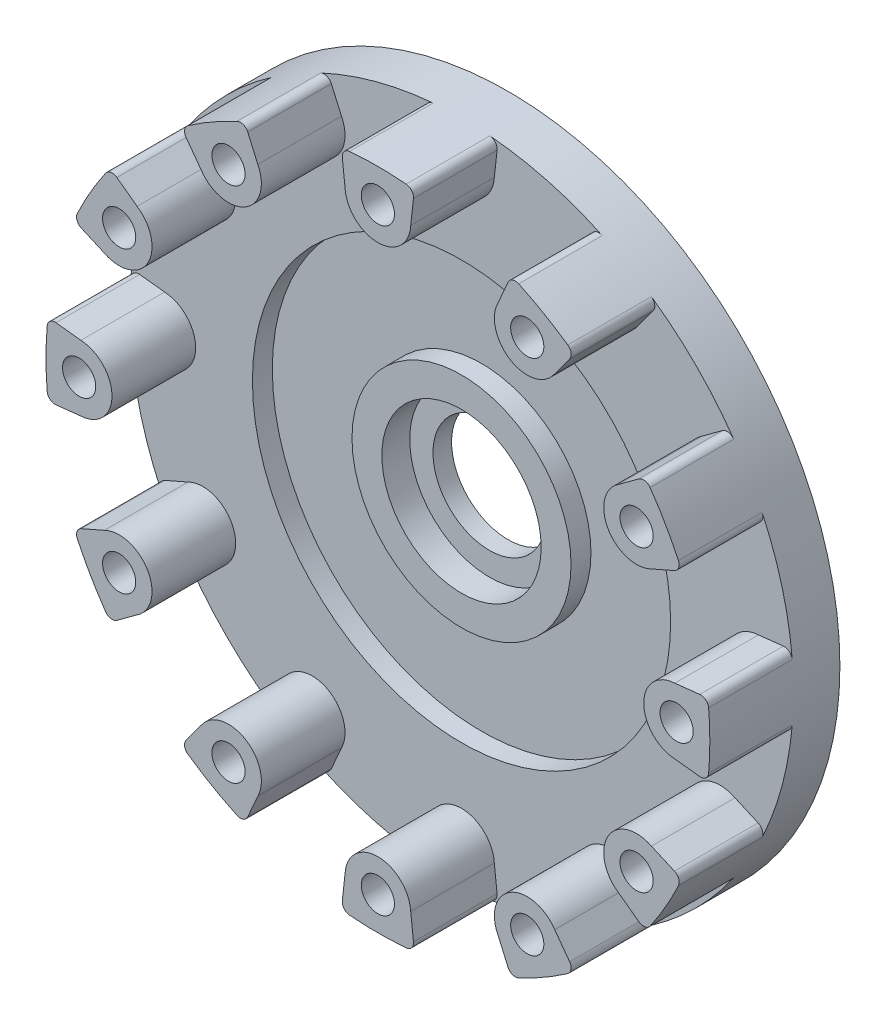
from build123d import *
from build123d.topology import SkipClean

# Parameters (mm, degrees)
SKETCH1_R           = 50
BOSS_EXTRUDE1_DEPTH = 7
BOSS_EXTRUDE2_START = 12.6
SKETCH2_R           = 2.5
BOSS_EXTRUDE2_DEPTH = 12.6
CIRPATTERN1_COUNT   = 12
SKETCH3_R           = 12
CUT_EXTRUDE1_DEPTH  = 72.824508352
SKETCH4_R           = 31.5
SKETCH4_R_2         = 16.5
CUT_EXTRUDE2_DEPTH  = 3
BOSS_EXTRUDE3_START = -4.2
SKETCH5_R           = 12
SKETCH5_R_2         = 8.5
BOSS_EXTRUDE3_DEPTH = 2.8
SCALE1_SCALE        = 0.4


with BuildPart() as part:
    # Sketch1 → Boss-Extrude1 (new body)
    with BuildSketch(Plane.XY):
        Circle(SKETCH1_R)
    extrude(amount=-BOSS_EXTRUDE1_DEPTH)

    # Sketch2 → Boss-Extrude2 (add)
    with BuildSketch(Plane.XY.offset(BOSS_EXTRUDE2_START)):
        with BuildLine():
            Line((44.72775, 4.942507454), (48.490092946, 5.358254011))
            ThreePointArc((48.490092946, 5.358254011), (49.383550497, 5.092810123), (49.817513468, 4.267944684))
            ThreePointArc((49.817513468, 4.267944684), (50, 0), (49.817513468, -4.267944684))
            ThreePointArc((49.817513468, -4.267944684), (49.383550497, -5.092810123), (48.490092946, -5.358254011))
            Line((48.490092946, -5.358254011), (44.72775, -4.942507454))
            ThreePointArc((44.72775, -4.942507454), (40.05, 0), (44.72775, 4.942507454))
        make_face()
        with Locations((45, 0)):
            Circle(SKETCH2_R, mode=Mode.SUBTRACT)
    boss_extrude2 = extrude(amount=-BOSS_EXTRUDE2_DEPTH)

    # CirPattern1: Boss-Extrude2 ×12 about axis
    with SkipClean():  # the faces are left unmerged after this step: merging them gives an invalid solid
        cirpattern1_axis = Axis((0, 0, 0), (0, 0, 1))
        for i in range(1, CIRPATTERN1_COUNT):
            add(boss_extrude2.rotate(cirpattern1_axis, i * 360 / CIRPATTERN1_COUNT))

    # Sketch3 → Cut-Extrude1 (cut, through all)
    with SkipClean():  # the faces are left unmerged after this step: merging them gives an invalid solid
        with BuildSketch(Plane.XY):
            Circle(SKETCH3_R)
        extrude(amount=-CUT_EXTRUDE1_DEPTH, mode=Mode.SUBTRACT)

    # Sketch4 → Cut-Extrude2 (cut)
    with SkipClean():  # the faces are left unmerged after this step: merging them gives an invalid solid
        with BuildSketch(Plane.XY):
            Circle(SKETCH4_R)
            Circle(SKETCH4_R_2, mode=Mode.SUBTRACT)
        extrude(amount=-CUT_EXTRUDE2_DEPTH, mode=Mode.SUBTRACT)

    # Sketch5 → Boss-Extrude3 (add)
    with SkipClean():  # the faces are left unmerged after this step: merging them gives an invalid solid
        with BuildSketch(Plane.XY.offset(BOSS_EXTRUDE3_START)):
            Circle(SKETCH5_R)
            Circle(SKETCH5_R_2, mode=Mode.SUBTRACT)
        extrude(amount=-BOSS_EXTRUDE3_DEPTH)


with BuildPart() as part_1:
    # Scale1: scaled about (0, 0, -1.929689798)
    add(part.part.scale(SCALE1_SCALE).moved(Location((0, 0, -1.157813879))))


solid = part_1.part
